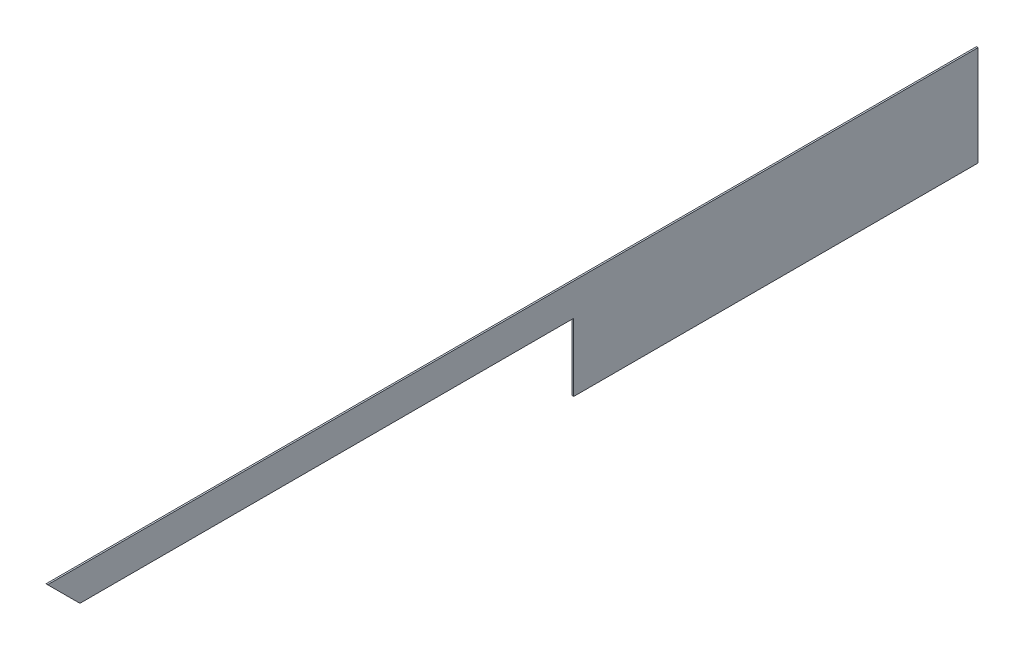
from build123d import *

# Parameters (mm, degrees)
BOSS_EXTRUDE1_DEPTH = 1


with BuildPart() as part:
    # Sketch2 → Boss-Extrude1 (new body)
    with BuildSketch(Plane(origin=(0, 0, 0), x_dir=(0, 0, -1), z_dir=(1, 0, 0))):
        Polygon((288.35, 31), (-288.35, 31), (-268.317715349, 11), (-261.282205757, 11), (37.75, 11), (37.75, -31), (288.35, -31), align=None)
    extrude(amount=BOSS_EXTRUDE1_DEPTH)


solid = part.part
